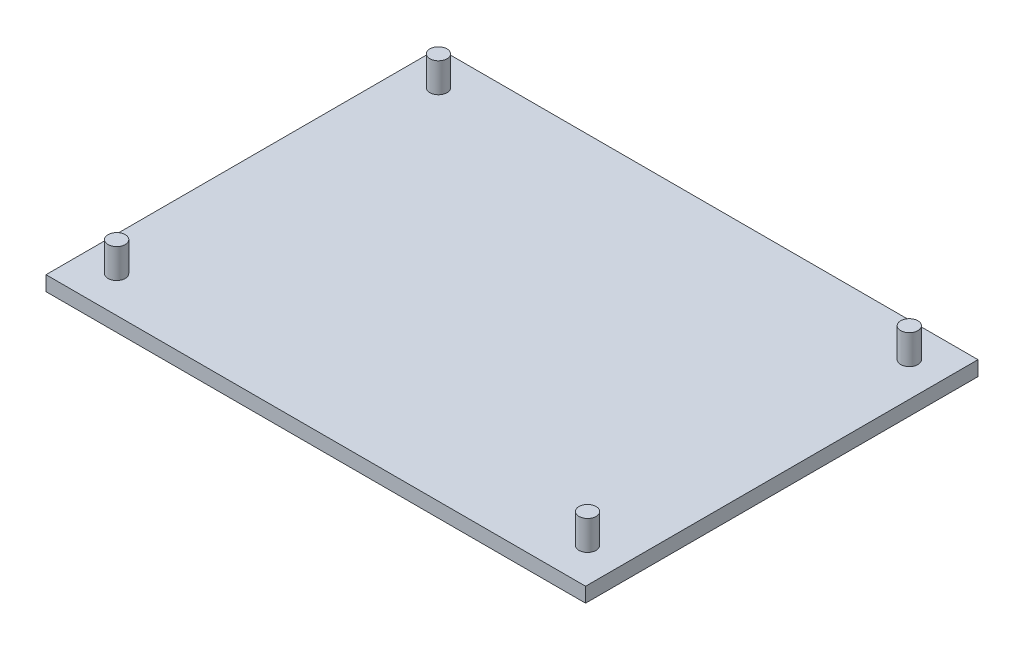
from build123d import *

# Parameters (mm, degrees)
ESQUISSE1_W        = 110
ESQUISSE1_H        = 80
BOSS_EXTRU_1_DEPTH = 3
ESQUISSE2_R        = 1.75
BOSS_EXTRU_2_DEPTH = 6


with BuildPart() as part:
    # Esquisse1 → Boss.-Extru.1 (new body)
    with BuildSketch(Plane(origin=(0, 0, 0), x_dir=(1, 0, 0), z_dir=(0, 1, 0))):
        Rectangle(ESQUISSE1_W, ESQUISSE1_H)
    extrude(amount=BOSS_EXTRU_1_DEPTH)

    # Esquisse2 → Boss.-Extru.2 (add)
    with BuildSketch(Plane(origin=(0, 3, 0), x_dir=(1, 0, 0), z_dir=(0, 1, 0))):
        with Locations(Location((-48, 33, 0), (0, 0, 90))):
            Circle(ESQUISSE2_R)
        with Locations(Location((-48, -32.6, 0), (0, 0, 90))):
            Circle(ESQUISSE2_R)
        with Locations(Location((48, -32.6, 0), (0, 0, 90))):
            Circle(ESQUISSE2_R)
        with Locations(Location((48, 33, 0), (0, 0, 90))):
            Circle(ESQUISSE2_R)
    extrude(amount=BOSS_EXTRU_2_DEPTH)


solid = part.part
